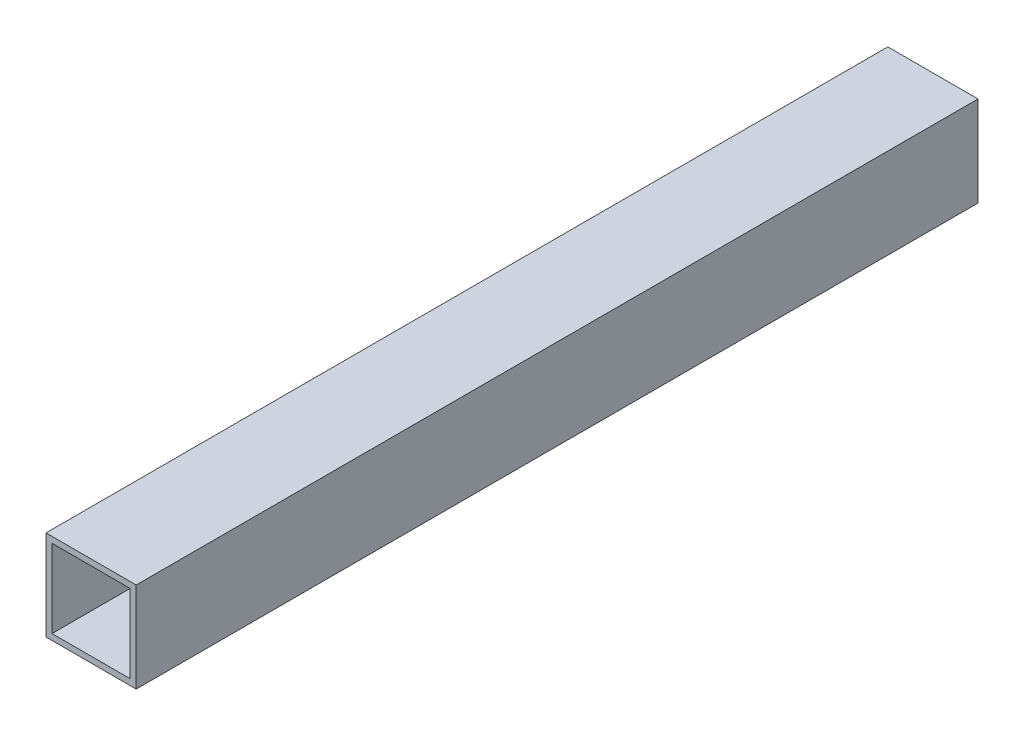
from build123d import *

# Parameters (mm, degrees)
SKETCH1_W           = 15
SKETCH1_H           = 15
SKETCH1_W_2         = 13
SKETCH1_H_2         = 13
BOSS_EXTRUDE1_DEPTH = 140


with BuildPart() as part:
    # Sketch1 → Boss-Extrude1 (new body)
    with BuildSketch(Plane.XY):
        Rectangle(SKETCH1_W, SKETCH1_H)
        Rectangle(SKETCH1_W_2, SKETCH1_H_2, mode=Mode.SUBTRACT)
    extrude(amount=BOSS_EXTRUDE1_DEPTH)


solid = part.part
